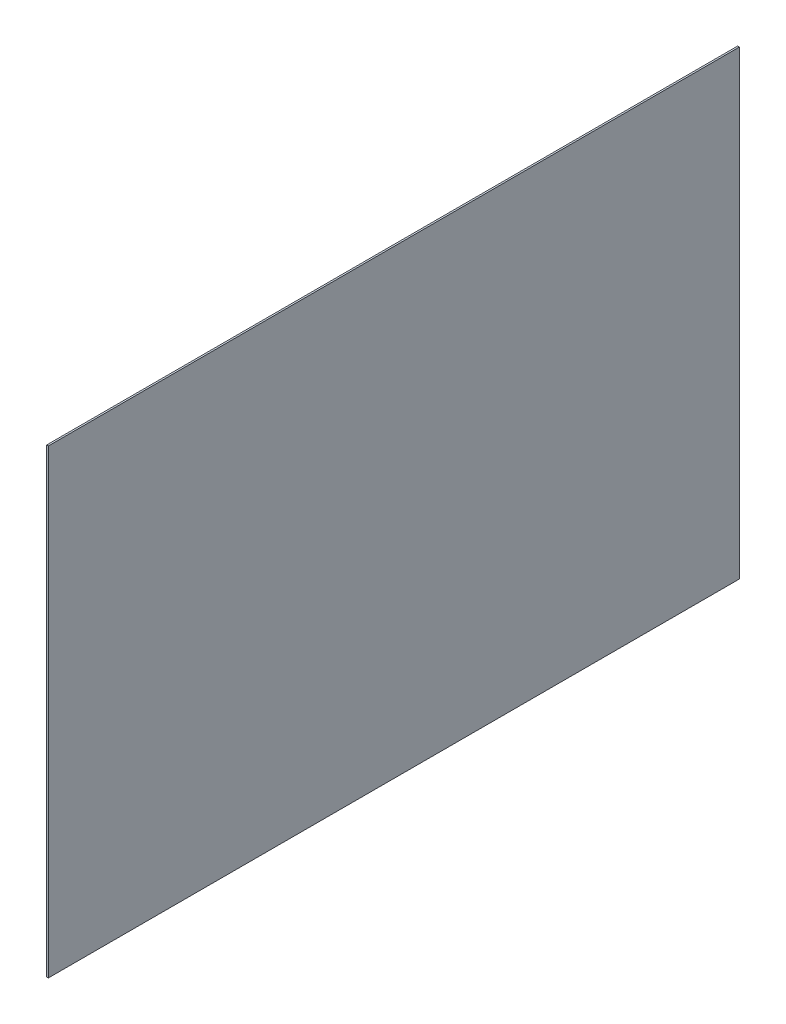
from build123d import *

# Parameters (mm, degrees)
SKETCH_1_W      = 300
SKETCH_1_H      = 200
EXTRUDE_1_DEPTH = 0.75
SKETCH_2_W      = 297
SKETCH_2_H      = 197
EXTRUDE_2_DEPTH = 0.75


with BuildPart() as part:
    # Эскиз1 → Бобышка-Вытянуть1 (new body)
    with BuildSketch(Plane(origin=(0, 0, 0), x_dir=(0, 0, -1), z_dir=(1, 0, 0))):
        Rectangle(SKETCH_1_W, SKETCH_1_H)
    extrude(amount=-EXTRUDE_1_DEPTH)

    # Эскиз2 → Бобышка-Вытянуть2 (add)
    with BuildSketch(Plane.ZY.offset(0.75)):
        Rectangle(SKETCH_2_W, SKETCH_2_H)
    extrude(amount=EXTRUDE_2_DEPTH)


solid = part.part
